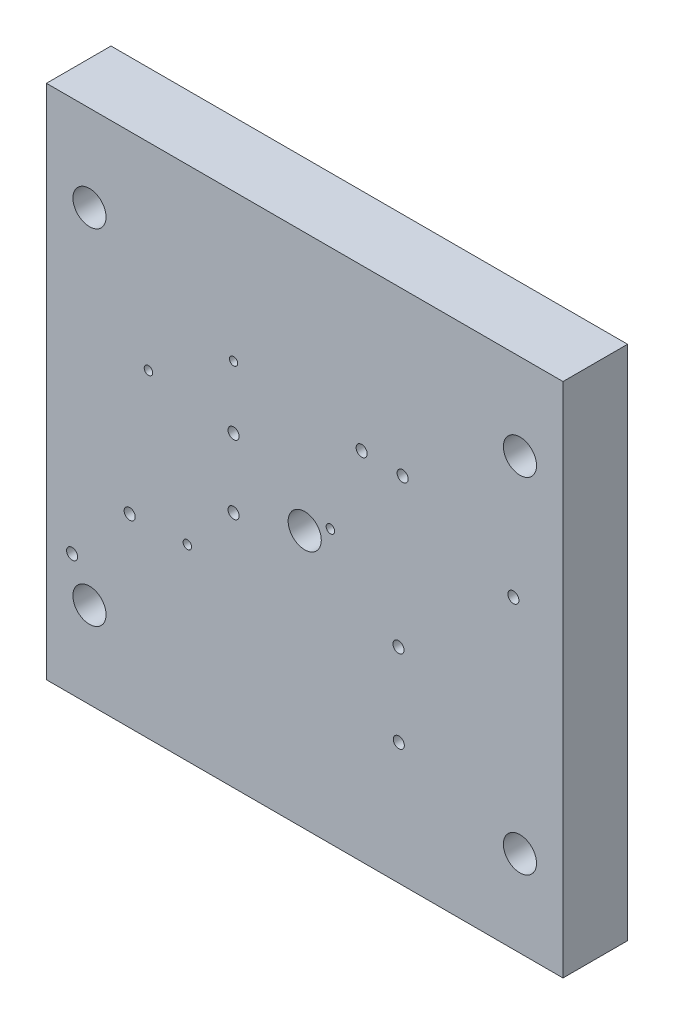
from build123d import *

# Parameters (mm, degrees)
SKETCH1_W                = 304.8
SKETCH1_H                = 304.8
BOSS_EXTRUDE1_DEPTH      = 38.1
SKETCH2_R                = 6.5151
HAAS_T_SLOT_HOLES_DEPTH  = 219.867836833
SKETCH3_R                = 9.779
HAAS_COUNTER_BORES_DEPTH = 22.225
SKETCH4_R                = 3.2639
CUT_EXTRUDE1_DEPTH       = 19.05
SKETCH5_R                = 2.414626773
SKETCH5_R_2              = 2.5
CUT_EXTRUDE2_DEPTH       = 12.7


with BuildPart() as part:
    # Sketch1 → Boss-Extrude1 (new body)
    with BuildSketch(Plane.XY):
        Rectangle(SKETCH1_W, SKETCH1_H)
    extrude(amount=BOSS_EXTRUDE1_DEPTH)

    # Sketch2 → HAAS T-Slot Holes (cut, through all)
    with BuildSketch(Plane.XY.offset(38.1)):
        with Locations((-127, 101.6)):
            Circle(SKETCH2_R)
        with Locations((127, 101.6)):
            Circle(SKETCH2_R)
        with Locations((127, -101.6)):
            Circle(SKETCH2_R)
        with Locations((-127, -101.6)):
            Circle(SKETCH2_R)
        Circle(SKETCH2_R)
    extrude(amount=-HAAS_T_SLOT_HOLES_DEPTH, mode=Mode.SUBTRACT)

    # Sketch3 → HAAS Counter Bores (cut)
    with BuildSketch(Plane.XY.offset(38.1)):
        with Locations((-127, 101.6)):
            Circle(SKETCH3_R)
        with Locations((127, 101.6)):
            Circle(SKETCH3_R)
        Circle(SKETCH3_R)
        with Locations((127, -101.6)):
            Circle(SKETCH3_R)
        with Locations((-127, -101.6)):
            Circle(SKETCH3_R)
    extrude(amount=-HAAS_COUNTER_BORES_DEPTH, mode=Mode.SUBTRACT)

    # Sketch4 → Cut-Extrude1 (cut)
    with BuildSketch(Plane.XY.offset(38.1)):
        with Locations((55.338636384, -31.78626265)):
            Circle(SKETCH4_R)
        with Locations((-103.268864702, -43.062839234)):
            Circle(SKETCH4_R)
        with Locations((-41.984915865, -11.846060915)):
            Circle(SKETCH4_R)
        with Locations((-41.984915865, 28.793939085)):
            Circle(SKETCH4_R)
        with Locations((123.115084135, 27.523939085)):
            Circle(SKETCH4_R)
        with Locations((-137.234915865, -80.426060915)):
            Circle(SKETCH4_R)
        with Locations((55.514563309, -80.426060915)):
            Circle(SKETCH4_R)
        with Locations((33.602258032, 57.632075165)):
            Circle(SKETCH4_R)
        with Locations((57.786056257, 56.797137583)):
            Circle(SKETCH4_R)
    extrude(amount=-CUT_EXTRUDE1_DEPTH, mode=Mode.SUBTRACT)

    # Sketch5 → Cut-Extrude2 (cut)
    with BuildSketch(Plane.XY.offset(38.1)):
        with Locations((-41.984915865, 65.623939085)):
            Circle(SKETCH5_R)
        with Locations((-92.209313854, 35.743562234)):
            Circle(SKETCH5_R_2)
        with Locations((-69.254539014, -41.750458903)):
            Circle(SKETCH5_R_2)
        with Locations((15.165084135, 8.473939085)):
            Circle(SKETCH5_R_2)
    extrude(amount=-CUT_EXTRUDE2_DEPTH, mode=Mode.SUBTRACT)


solid = part.part
